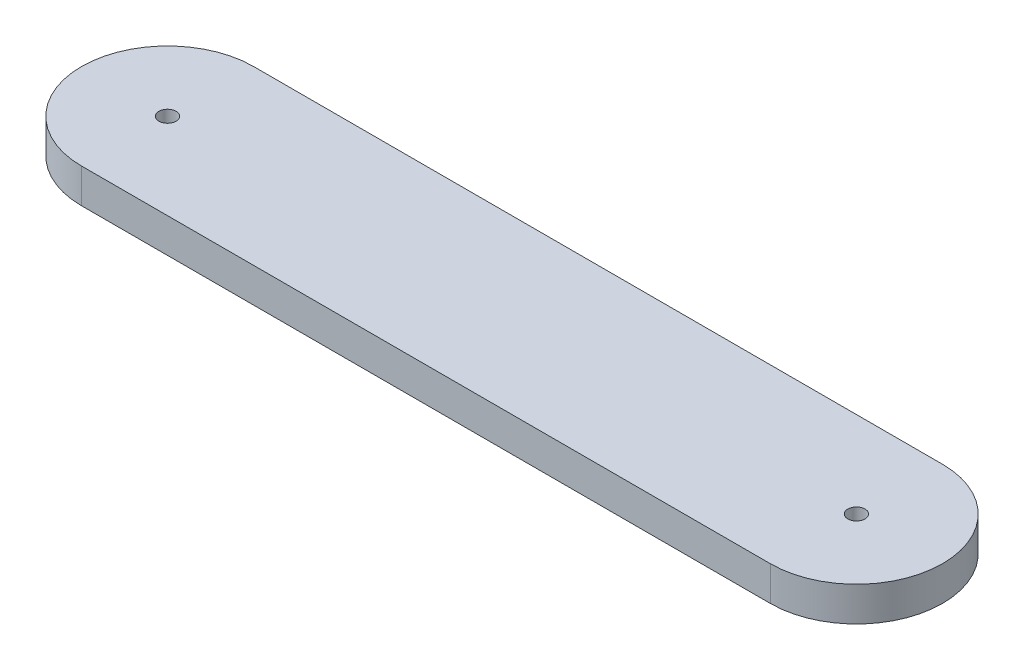
from build123d import *

# Parameters (mm, degrees)
SKETCH2_R           = 2.5
BOSS_EXTRUDE2_DEPTH = 10


with BuildPart() as part:
    # Sketch2 → Boss-Extrude2 (new body)
    with BuildSketch(Plane(origin=(0, 0, 0), x_dir=(1, 0, 0), z_dir=(0, 1, 0))):
        with BuildLine():
            Line((0, 25), (200, 25))
            ThreePointArc((200, 25), (225, 0), (200, -25))
            Line((200, -25), (0, -25))
            ThreePointArc((0, -25), (-25, 0), (0, 25))
        make_face()
        with Locations(Location((0, 0, 0), (0, 0, 270))):
            Circle(SKETCH2_R, mode=Mode.SUBTRACT)
        with Locations(Location((200, 0, 0), (0, 0, 270))):
            Circle(SKETCH2_R, mode=Mode.SUBTRACT)
    extrude(amount=BOSS_EXTRUDE2_DEPTH)


solid = part.part
